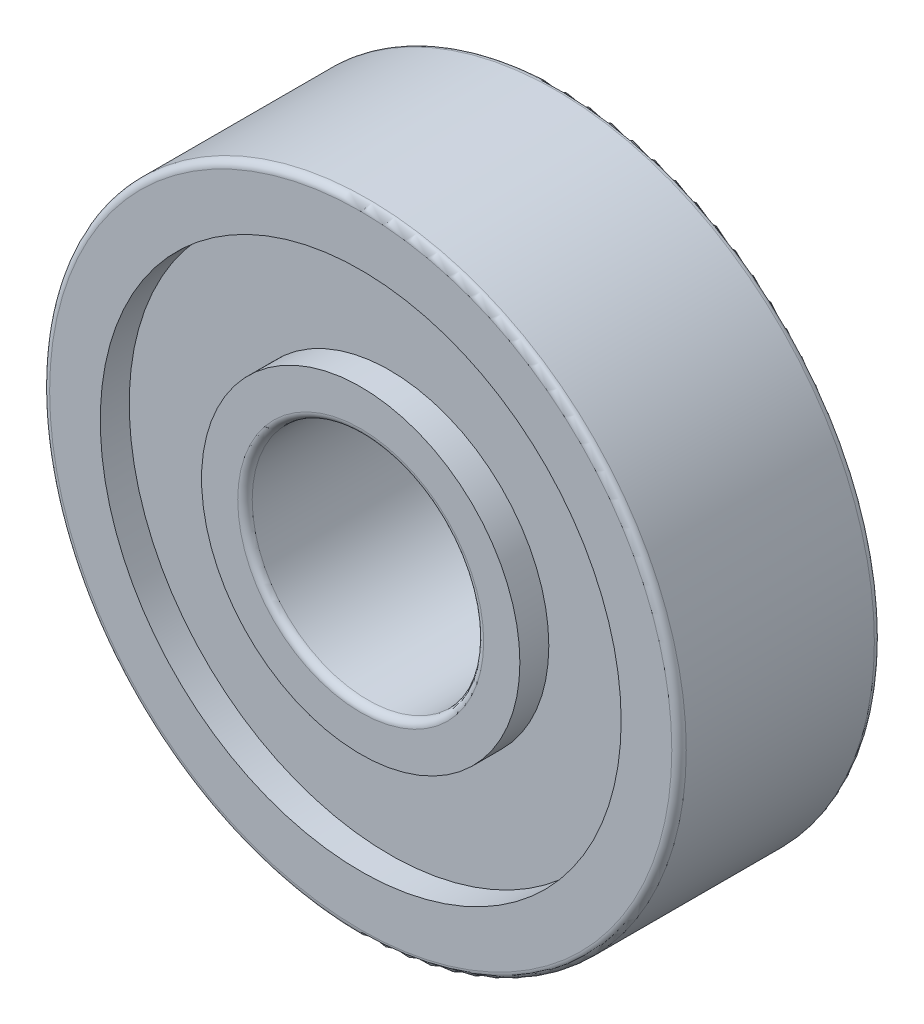
from build123d import *

# Parameters (mm, degrees)
ESQUISSE1_R      = 11
ESQUISSE1_R_2    = 4
EXTRUSION1_DEPTH = 7
CONG_1_R         = 0.25
ESQUISSE2_R      = 9
ESQUISSE2_R_2    = 5.5
EXTRUSION2_DEPTH = 1
EXTRUSION3_START = -1
ESQUISSE3_R      = 9
ESQUISSE3_R_2    = 5.5
EXTRUSION3_DEPTH = 1


with BuildPart() as part:
    # Esquisse1 → Extrusion1 (new body)
    with BuildSketch(Plane.XY):
        Circle(ESQUISSE1_R)
        Circle(ESQUISSE1_R_2, mode=Mode.SUBTRACT)
    extrude(amount=EXTRUSION1_DEPTH)

    # Congé1
    cong_1_edges = [part.edges().sort_by_distance(p)[0] for p in [
        (-11, 0, 0),
        (-11, 0, 7),
        (-4, 0, 0),
        (-4, 0, 7),
    ]]
    fillet(cong_1_edges, radius=CONG_1_R)

    # Esquisse2 → Extrusion2 (cut)
    with BuildSketch(Plane.XY.offset(7)):
        Circle(ESQUISSE2_R)
        Circle(ESQUISSE2_R_2, mode=Mode.SUBTRACT)
    extrude(amount=-EXTRUSION2_DEPTH, mode=Mode.SUBTRACT)

    # Esquisse3 → Extrusion3 (cut)
    with BuildSketch(Plane(origin=(0, 0, 0), x_dir=(-1, 0, 0), z_dir=(0, 0, -1)).offset(EXTRUSION3_START)):
        with Locations(Location((0, 0, 0), (0, 0, 180))):
            Circle(ESQUISSE3_R)
        with Locations(Location((0, 0, 0), (0, 0, 180))):
            Circle(ESQUISSE3_R_2, mode=Mode.SUBTRACT)
    extrude(amount=EXTRUSION3_DEPTH, mode=Mode.SUBTRACT)


solid = part.part
